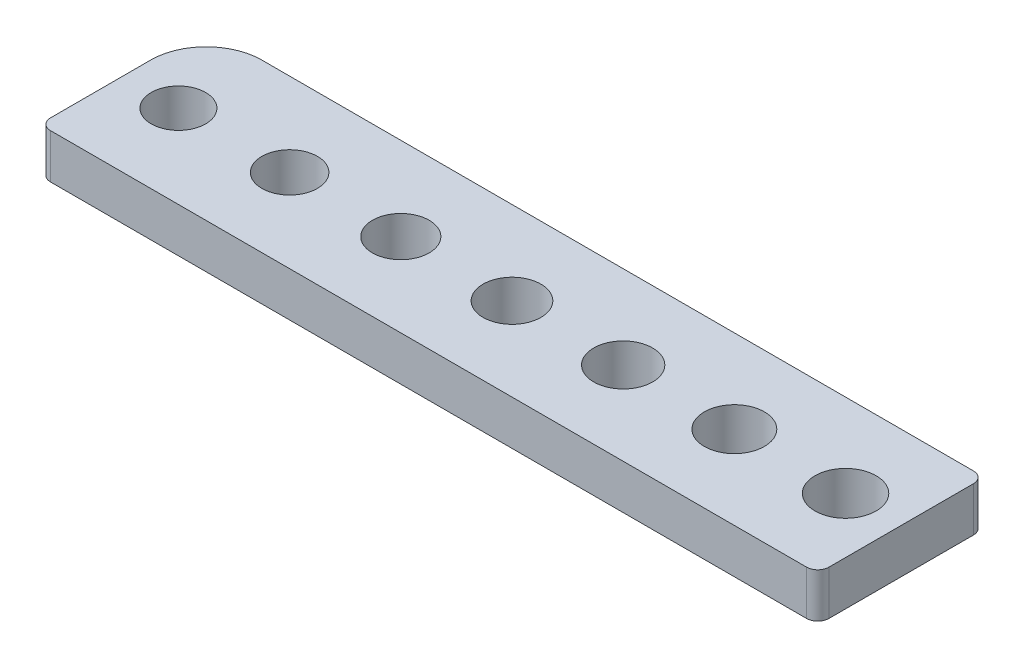
from build123d import *

# Parameters (mm, degrees)
SKETCH1_W           = 70
SKETCH1_H           = 15
SKETCH1_R           = 2.45
SKETCH1_R_2         = 2.5
SKETCH1_R_3         = 2.55
SKETCH1_R_4         = 2.6
SKETCH1_R_5         = 2.65
SKETCH1_R_6         = 2.7
SKETCH1_R_7         = 2.75
BOSS_EXTRUDE1_DEPTH = 4
FILLET1_R           = 5
FILLET2_R           = 1


with BuildPart() as part:
    # Sketch1 → Boss-Extrude1 (new body)
    with BuildSketch(Plane(origin=(0, 0, 0), x_dir=(1, 0, 0), z_dir=(0, 1, 0))):
        Rectangle(SKETCH1_W, SKETCH1_H)
        with Locations(Location((-30, 0, 0), (0, 0, 270))):
            Circle(SKETCH1_R, mode=Mode.SUBTRACT)
        with Locations(Location((-20, 0, 0), (0, 0, 270))):
            Circle(SKETCH1_R_2, mode=Mode.SUBTRACT)
        with Locations(Location((-10, 0, 0), (0, 0, 270))):
            Circle(SKETCH1_R_3, mode=Mode.SUBTRACT)
        with Locations(Location((0, 0, 0), (0, 0, 270))):
            Circle(SKETCH1_R_4, mode=Mode.SUBTRACT)
        with Locations(Location((10, 0, 0), (0, 0, 270))):
            Circle(SKETCH1_R_5, mode=Mode.SUBTRACT)
        with Locations(Location((20, 0, 0), (0, 0, 270))):
            Circle(SKETCH1_R_6, mode=Mode.SUBTRACT)
        with Locations(Location((30, 0, 0), (0, 0, 270))):
            Circle(SKETCH1_R_7, mode=Mode.SUBTRACT)
    extrude(amount=BOSS_EXTRUDE1_DEPTH)

    # Fillet1
    fillet1_edges = [part.edges().sort_by_distance(p)[0] for p in [
        (-35, 2, -7.5),
    ]]
    fillet(fillet1_edges, radius=FILLET1_R)

    # Fillet2
    fillet2_edges = [part.edges().sort_by_distance(p)[0] for p in [
        (35, 2, 7.5),
        (-35, 2, 7.5),
        (35, 2, -7.5),
    ]]
    fillet(fillet2_edges, radius=FILLET2_R)


solid = part.part
